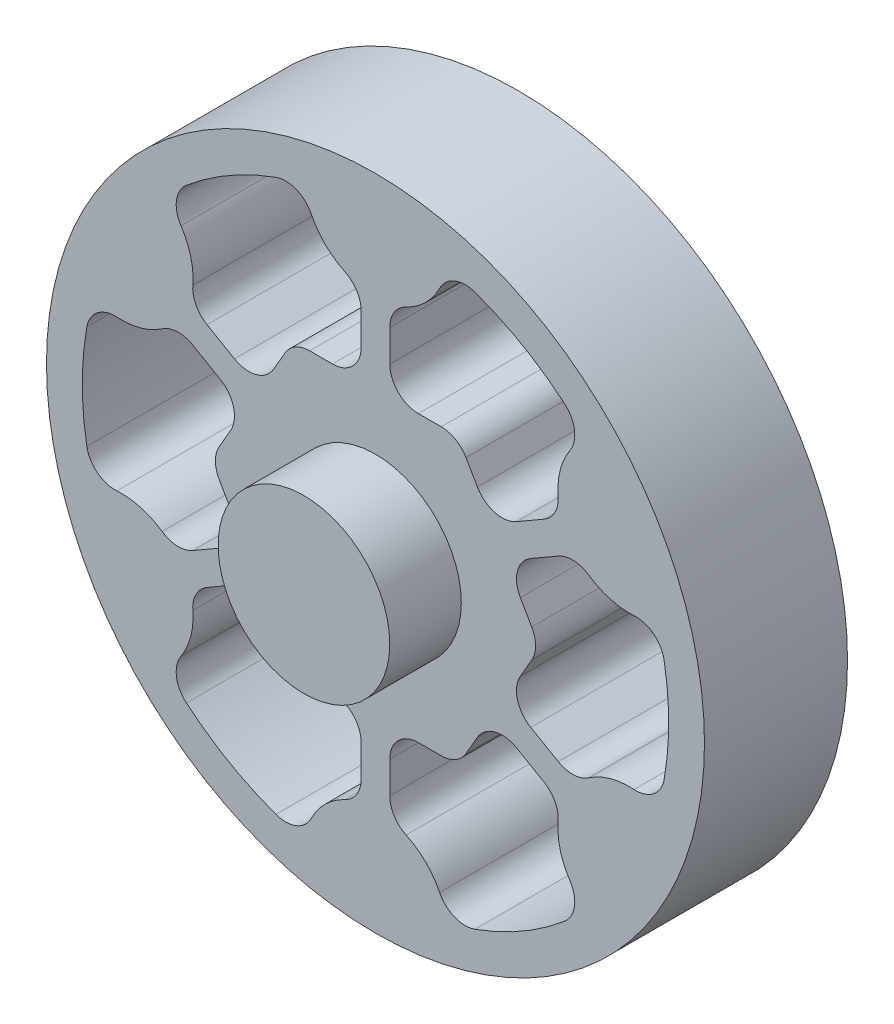
from build123d import *

# Parameters (mm, degrees)
SKETCH1_R           = 6
BOSS_EXTRUDE1_DEPTH = 10
SKETCH1_7_R         = 23
SKETCH1_7_R_2       = 6
BOSS_EXTRUDE3_DEPTH = 5


with BuildPart() as part:
    # Sketch1 → Boss-Extrude1 (new, symmetric)
    with BuildSketch(Plane.XY):
        Circle(SKETCH1_R)
    extrude(amount=BOSS_EXTRUDE1_DEPTH, both=True)

    # Sketch1<7> → Boss-Extrude3 (add, symmetric)
    with BuildSketch(Plane.XY):
        Circle(SKETCH1_7_R)
        Circle(SKETCH1_7_R_2, mode=Mode.SUBTRACT)
        with BuildLine():
            Line((-1, 14.17544468), (-1, 11.959292144))
            ThreePointArc((-1, 11.959292144), (-1.585786438, 10.545078581), (-3, 9.959292144))
            Line((-3, 9.959292144), (-4.595299462, 9.959292144))
            ThreePointArc((-4.595299462, 9.959292144), (-5.595299462, 9.691342951), (-6.327350269, 8.959292144))
            Line((-6.327350269, 8.959292144), (-7.125, 7.577722283))
            ThreePointArc((-7.125, 7.577722283), (-8.339412717, 6.645870631), (-9.857050808, 6.845671476))
            Line((-9.857050808, 6.845671476), (-11.776295203, 7.953747744))
            ThreePointArc((-11.776295203, 7.953747744), (-12.547269557, 8.756470926), (-12.769788224, 9.846998965))
            ThreePointArc((-12.769788224, 9.846998965), (-12.914018091, 11.506667717), (-13.595491338, 13.02683114))
            ThreePointArc((-13.595491338, 13.02683114), (-13.912573816, 14.417625499), (-13.222255731, 15.66594885))
            ThreePointArc((-13.222255731, 15.66594885), (-10.25, 17.753520778), (-6.955981813, 19.283783784))
            ThreePointArc((-6.955981813, 19.283783784), (-5.529743036, 19.257455106), (-4.483821029, 18.287456446))
            ThreePointArc((-4.483821029, 18.287456446), (-3.50805751, 16.937201591), (-2.142857143, 15.982460485))
            ThreePointArc((-2.142857143, 15.982460485), (-1.309691491, 15.244489647), (-1, 14.17544468))
        make_face(mode=Mode.SUBTRACT)
        with BuildLine():
            Line((4.595299462, 9.959292144), (3, 9.959292144))
            ThreePointArc((3, 9.959292144), (1.585786438, 10.545078581), (1, 11.959292144))
            Line((1, 11.959292144), (1, 14.17544468))
            ThreePointArc((1, 14.17544468), (1.309691491, 15.244489647), (2.142857143, 15.982460485))
            ThreePointArc((2.142857143, 15.982460485), (3.50805751, 16.937201591), (4.483821029, 18.287456446))
            ThreePointArc((4.483821029, 18.287456446), (5.529743036, 19.257455106), (6.955981813, 19.283783784))
            ThreePointArc((6.955981813, 19.283783784), (10.25, 17.753520778), (13.222255731, 15.66594885))
            ThreePointArc((13.222255731, 15.66594885), (13.912573816, 14.417625499), (13.595491338, 13.02683114))
            ThreePointArc((13.595491338, 13.02683114), (12.914018091, 11.506667717), (12.769788224, 9.846998965))
            ThreePointArc((12.769788224, 9.846998965), (12.547269557, 8.756470926), (11.776295203, 7.953747744))
            Line((11.776295203, 7.953747744), (9.857050808, 6.845671476))
            ThreePointArc((9.857050808, 6.845671476), (8.339412717, 6.645870631), (7.125, 7.577722283))
            Line((7.125, 7.577722283), (6.327350269, 8.959292144))
            ThreePointArc((6.327350269, 8.959292144), (5.595299462, 9.691342951), (4.595299462, 9.959292144))
        make_face(mode=Mode.SUBTRACT)
        with BuildLine():
            Line((-10.922649731, -1), (-10.125, -2.38156986))
            ThreePointArc((-10.125, -2.38156986), (-9.925199155, -3.899207951), (-10.857050808, -5.113620668))
            Line((-10.857050808, -5.113620668), (-12.776295203, -6.221696936))
            ThreePointArc((-12.776295203, -6.221696936), (-13.856961048, -6.488018722), (-14.912645367, -6.13546152))
            ThreePointArc((-14.912645367, -6.13546152), (-16.422075601, -5.430533874), (-18.079312367, -5.260625306))
            ThreePointArc((-18.079312367, -5.260625306), (-19.442316853, -4.839829607), (-20.178237544, -3.617834934))
            ThreePointArc((-20.178237544, -3.617834934), (-20.5, 0), (-20.178237544, 3.617834934))
            ThreePointArc((-20.178237544, 3.617834934), (-19.442316853, 4.839829607), (-18.079312367, 5.260625306))
            ThreePointArc((-18.079312367, 5.260625306), (-16.422075601, 5.430533874), (-14.912645367, 6.13546152))
            ThreePointArc((-14.912645367, 6.13546152), (-13.856961048, 6.488018722), (-12.776295203, 6.221696936))
            Line((-12.776295203, 6.221696936), (-10.857050808, 5.113620668))
            ThreePointArc((-10.857050808, 5.113620668), (-9.925199155, 3.899207951), (-10.125, 2.38156986))
            Line((-10.125, 2.38156986), (-10.922649731, 1))
            ThreePointArc((-10.922649731, 1), (-11.190598923, 0), (-10.922649731, -1))
        make_face(mode=Mode.SUBTRACT)
        with BuildLine():
            Line((-4.595299462, -9.959292144), (-3, -9.959292144))
            ThreePointArc((-3, -9.959292144), (-1.585786438, -10.545078581), (-1, -11.959292144))
            Line((-1, -11.959292144), (-1, -14.17544468))
            ThreePointArc((-1, -14.17544468), (-1.309691491, -15.244489647), (-2.142857143, -15.982460485))
            ThreePointArc((-2.142857143, -15.982460485), (-3.50805751, -16.937201591), (-4.483821029, -18.287456446))
            ThreePointArc((-4.483821029, -18.287456446), (-5.529743036, -19.257455106), (-6.955981813, -19.283783784))
            ThreePointArc((-6.955981813, -19.283783784), (-10.25, -17.753520778), (-13.222255731, -15.66594885))
            ThreePointArc((-13.222255731, -15.66594885), (-13.912573816, -14.417625499), (-13.595491338, -13.02683114))
            ThreePointArc((-13.595491338, -13.02683114), (-12.914018091, -11.506667717), (-12.769788224, -9.846998965))
            ThreePointArc((-12.769788224, -9.846998965), (-12.547269557, -8.756470926), (-11.776295203, -7.953747744))
            Line((-11.776295203, -7.953747744), (-9.857050808, -6.845671476))
            ThreePointArc((-9.857050808, -6.845671476), (-8.339412717, -6.645870631), (-7.125, -7.577722283))
            Line((-7.125, -7.577722283), (-6.327350269, -8.959292144))
            ThreePointArc((-6.327350269, -8.959292144), (-5.595299462, -9.691342951), (-4.595299462, -9.959292144))
        make_face(mode=Mode.SUBTRACT)
        with BuildLine():
            Line((6.327350269, -8.959292144), (7.125, -7.577722283))
            ThreePointArc((7.125, -7.577722283), (8.339412717, -6.645870631), (9.857050808, -6.845671476))
            Line((9.857050808, -6.845671476), (11.776295203, -7.953747744))
            ThreePointArc((11.776295203, -7.953747744), (12.547269557, -8.756470926), (12.769788224, -9.846998965))
            ThreePointArc((12.769788224, -9.846998965), (12.914018091, -11.506667717), (13.595491338, -13.02683114))
            ThreePointArc((13.595491338, -13.02683114), (13.912573816, -14.417625499), (13.222255731, -15.66594885))
            ThreePointArc((13.222255731, -15.66594885), (10.25, -17.753520778), (6.955981813, -19.283783784))
            ThreePointArc((6.955981813, -19.283783784), (5.529743036, -19.257455106), (4.483821029, -18.287456446))
            ThreePointArc((4.483821029, -18.287456446), (3.50805751, -16.937201591), (2.142857143, -15.982460485))
            ThreePointArc((2.142857143, -15.982460485), (1.309691491, -15.244489647), (1, -14.17544468))
            Line((1, -14.17544468), (1, -11.959292144))
            ThreePointArc((1, -11.959292144), (1.585786438, -10.545078581), (3, -9.959292144))
            Line((3, -9.959292144), (4.595299462, -9.959292144))
            ThreePointArc((4.595299462, -9.959292144), (5.595299462, -9.691342951), (6.327350269, -8.959292144))
        make_face(mode=Mode.SUBTRACT)
        with BuildLine():
            Line((10.922649731, 1), (10.125, 2.38156986))
            ThreePointArc((10.125, 2.38156986), (9.925199155, 3.899207951), (10.857050808, 5.113620668))
            Line((10.857050808, 5.113620668), (12.776295203, 6.221696936))
            ThreePointArc((12.776295203, 6.221696936), (13.856961048, 6.488018722), (14.912645367, 6.13546152))
            ThreePointArc((14.912645367, 6.13546152), (16.422075601, 5.430533874), (18.079312367, 5.260625306))
            ThreePointArc((18.079312367, 5.260625306), (19.442316853, 4.839829607), (20.178237544, 3.617834934))
            ThreePointArc((20.178237544, 3.617834934), (20.5, 0), (20.178237544, -3.617834934))
            ThreePointArc((20.178237544, -3.617834934), (19.442316853, -4.839829607), (18.079312367, -5.260625306))
            ThreePointArc((18.079312367, -5.260625306), (16.422075601, -5.430533874), (14.912645367, -6.13546152))
            ThreePointArc((14.912645367, -6.13546152), (13.856961048, -6.488018722), (12.776295203, -6.221696936))
            Line((12.776295203, -6.221696936), (10.857050808, -5.113620668))
            ThreePointArc((10.857050808, -5.113620668), (9.925199155, -3.899207951), (10.125, -2.38156986))
            Line((10.125, -2.38156986), (10.922649731, -1))
            ThreePointArc((10.922649731, -1), (11.190598923, 0), (10.922649731, 1))
        make_face(mode=Mode.SUBTRACT)
    extrude(amount=BOSS_EXTRUDE3_DEPTH, both=True)


solid = part.part
